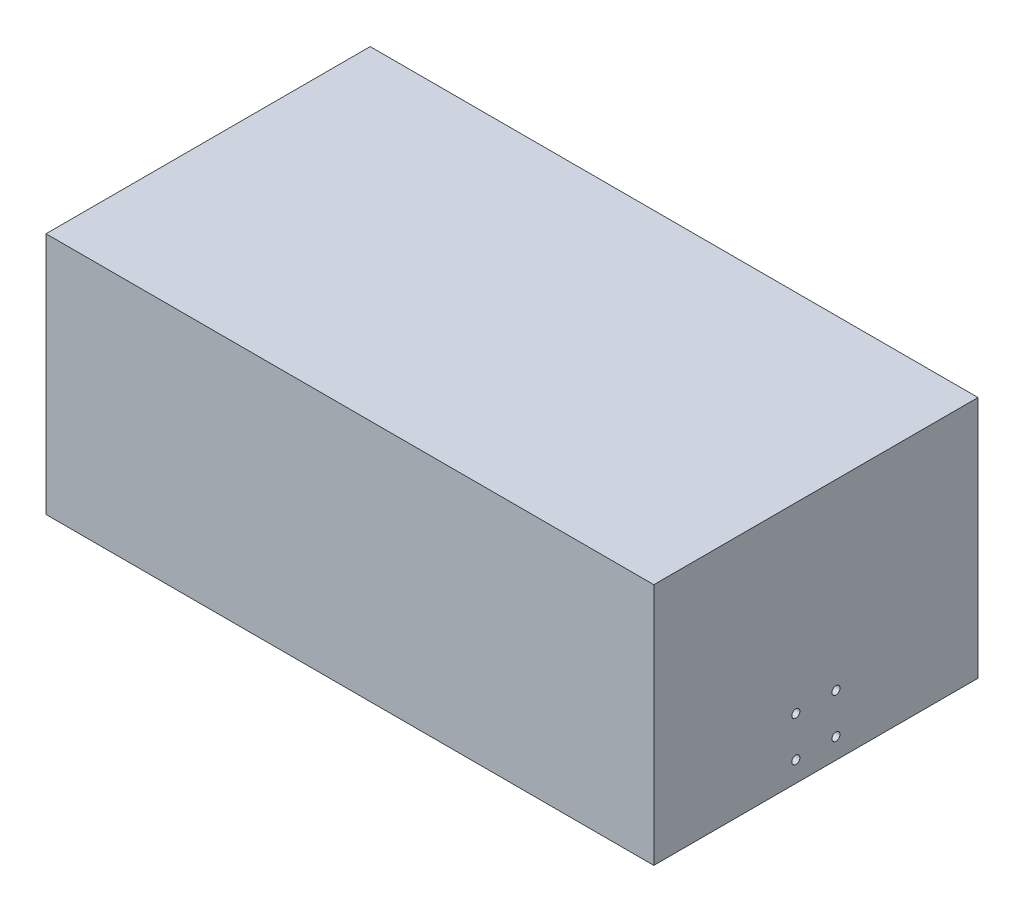
from build123d import *

# Parameters (mm, degrees)
SKETCH_1_W          = 150
SKETCH_1_H          = 80
EXTRUDE_1_DEPTH     = 60
SKETCH_2_R          = 1
CUT_EXTRUDE_2_DEPTH = 10


with BuildPart() as part:
    # Эскиз1 → Бобышка-Вытянуть1 (new body)
    with BuildSketch(Plane(origin=(0, 0, 0), x_dir=(1, 0, 0), z_dir=(0, 1, 0))):
        with Locations((75, 40)):
            Rectangle(SKETCH_1_W, SKETCH_1_H)
    extrude(amount=EXTRUDE_1_DEPTH)

    # Эскиз2 → Вырез-Вытянуть2 (cut)
    with BuildSketch(Plane(origin=(150, 0, 0), x_dir=(0, 0, -1), z_dir=(1, 0, 0))):
        with Locations((35.050252532, 14.949747468)):
            Circle(SKETCH_2_R)
        with Locations((44.949747468, 14.949747468)):
            Circle(SKETCH_2_R)
        with Locations((44.949747468, 5.050252532)):
            Circle(SKETCH_2_R)
        with Locations((35.050252532, 5.050252532)):
            Circle(SKETCH_2_R)
    extrude(amount=-CUT_EXTRUDE_2_DEPTH, mode=Mode.SUBTRACT)


solid = part.part
